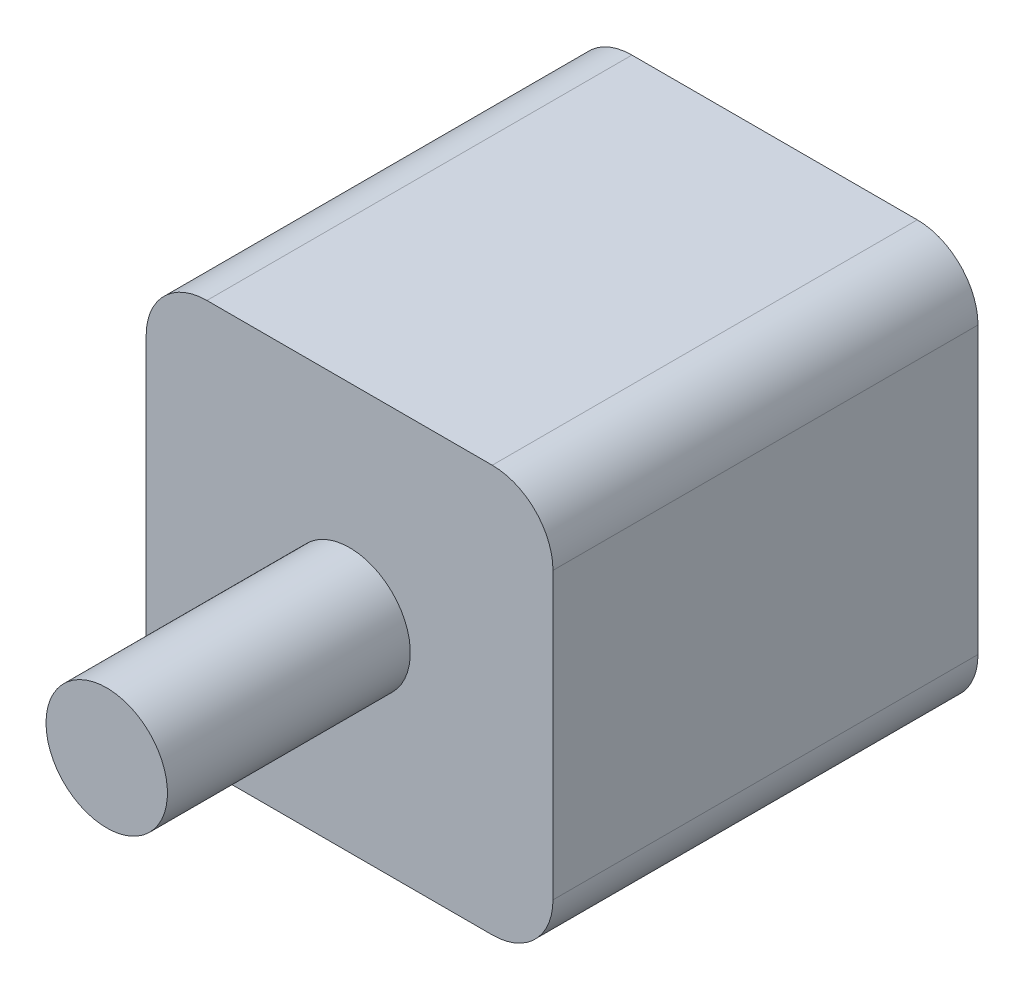
from build123d import *

# Parameters (mm, degrees)
SKETCH1_W           = 42.545
SKETCH1_H           = 42.545
BOSS_EXTRUDE1_DEPTH = 44.45
FILLET2_R           = 6.35
SKETCH2_R           = 6.35
BOSS_EXTRUDE2_DEPTH = 69.85


with BuildPart() as part:
    # Sketch1 → Boss-Extrude1 (new body)
    with BuildSketch(Plane.XY):
        with Locations((21.2725, 21.2725)):
            Rectangle(SKETCH1_W, SKETCH1_H)
    extrude(amount=BOSS_EXTRUDE1_DEPTH)

    # Fillet2
    fillet2_edges = [part.edges().sort_by_distance(p)[0] for p in [
        (0, 42.545, 22.225),
        (42.545, 42.545, 22.225),
        (42.545, 0, 22.225),
        (0, 0, 22.225),
    ]]
    fillet(fillet2_edges, radius=FILLET2_R)

    # Sketch2 → Boss-Extrude2 (add)
    with BuildSketch(Plane(origin=(0, 0, 0), x_dir=(-1, 0, 0), z_dir=(0, 0, -1))):
        with Locations((-21.2725, 21.2725)):
            Circle(SKETCH2_R)
    extrude(amount=-BOSS_EXTRUDE2_DEPTH)


solid = part.part
